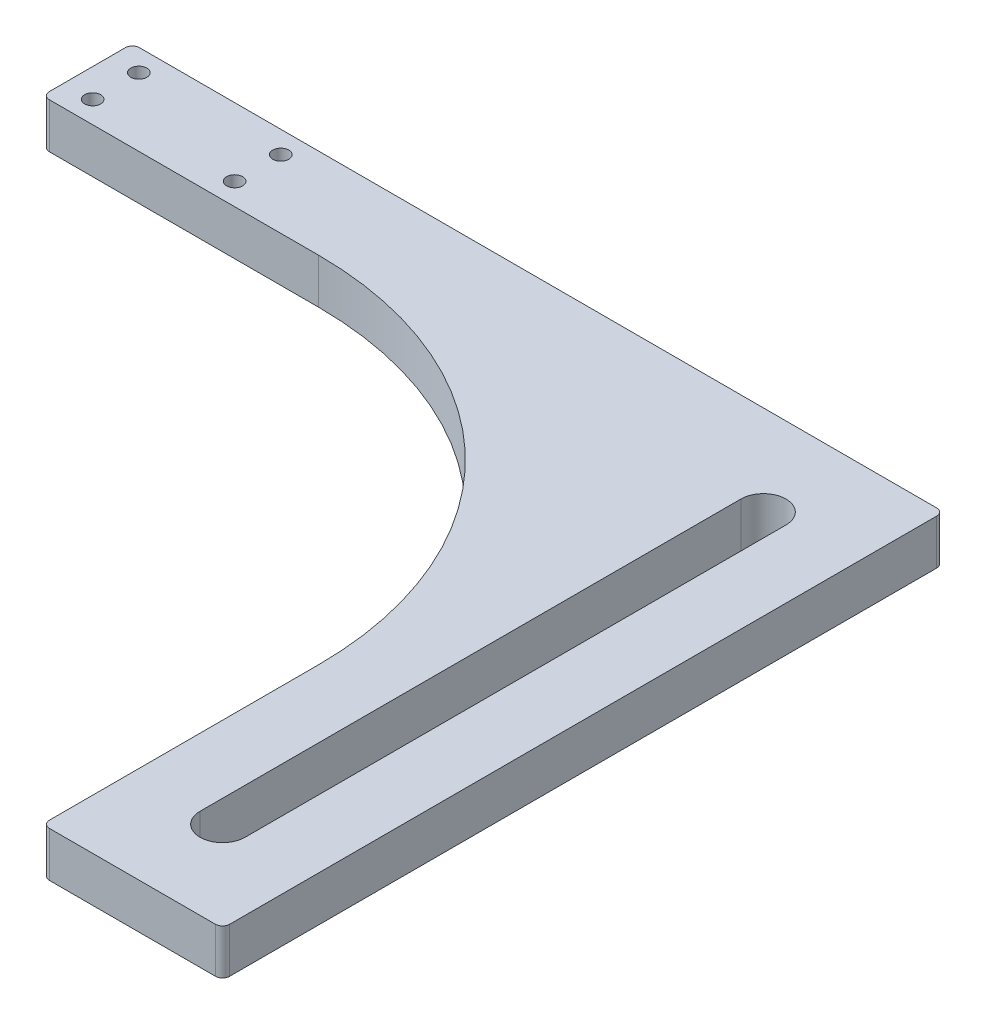
from build123d import *

# Parameters (mm, degrees)
SKETCH1_R           = 1.1303
BOSS_EXTRUDE2_DEPTH = 6.35
FILLET1_R           = 1


with BuildPart() as part:
    # Sketch1 → Boss-Extrude2 (new body)
    with BuildSketch(Plane(origin=(0, 0, 0), x_dir=(1, 0, 0), z_dir=(0, 1, 0))):
        with BuildLine():
            Line((-12.7, 50.8), (-101.6, 50.8))
            Line((-101.6, 50.8), (-101.6, 38.1))
            Line((-101.6, 38.1), (-62.7, 38.1))
            ThreePointArc((-62.7, 38.1), (-27.344660941, 23.455339059), (-12.7, -11.9))
            Line((-12.7, -11.9), (-12.7, -50.8))
            Line((-12.7, -50.8), (12.7, -50.8))
            Line((12.7, -50.8), (12.7, 50.8))
            Line((12.7, 50.8), (-12.7, 50.8))
        make_face()
        with Locations(Location((-97.6, 47.7, 0), (0, 0, 270))):
            Circle(SKETCH1_R, mode=Mode.SUBTRACT)
        with Locations(Location((-97.6, 41.2, 0), (0, 0, 270))):
            Circle(SKETCH1_R, mode=Mode.SUBTRACT)
        with Locations(Location((-77.6, 47.7, 0), (0, 0, 270))):
            Circle(SKETCH1_R, mode=Mode.SUBTRACT)
        with Locations(Location((-77.6, 41.2, 0), (0, 0, 270))):
            Circle(SKETCH1_R, mode=Mode.SUBTRACT)
        with BuildLine():
            Line((-3.175, -38.1), (-3.175, 38.1))
            ThreePointArc((-3.175, 38.1), (0, 41.275), (3.175, 38.1))
            Line((3.175, 38.1), (3.175, -38.1))
            ThreePointArc((3.175, -38.1), (0, -41.275), (-3.175, -38.1))
        make_face(mode=Mode.SUBTRACT)
    extrude(amount=BOSS_EXTRUDE2_DEPTH)

    # Fillet1
    fillet1_edges = [part.edges().sort_by_distance(p)[0] for p in [
        (12.7, 3.175, 50.8),
        (-12.7, 3.175, 50.8),
        (-101.6, 3.175, -38.1),
        (-101.6, 3.175, -50.8),
        (12.7, 3.175, -50.8),
    ]]
    fillet(fillet1_edges, radius=FILLET1_R)


solid = part.part
